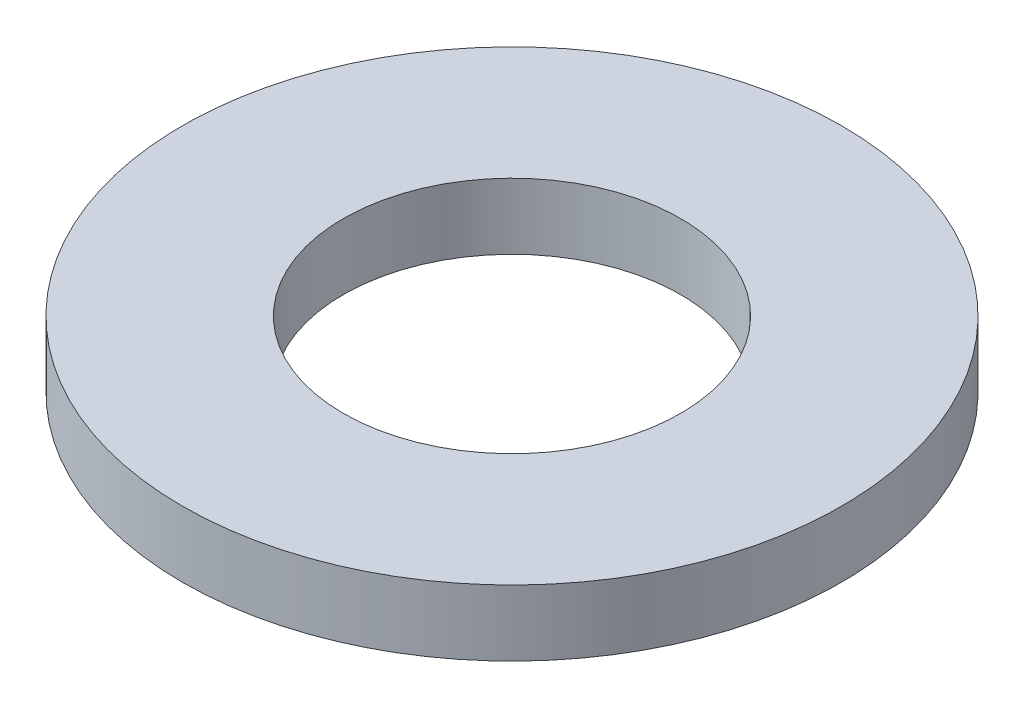
from build123d import *

# Parameters (mm, degrees)
SKETCH1_R           = 6.35
SKETCH1_R_2         = 3.2512
BOSS_EXTRUDE1_DEPTH = 1.27


with BuildPart() as part:
    # Sketch1 → Boss-Extrude1 (new body)
    with BuildSketch(Plane(origin=(0, 0, 0), x_dir=(1, 0, 0), z_dir=(0, 1, 0))):
        with Locations(Location((0, 0, 0), (0, 0, 270))):
            Circle(SKETCH1_R)
        with Locations(Location((0, 0, 0), (0, 0, 270))):
            Circle(SKETCH1_R_2, mode=Mode.SUBTRACT)
    extrude(amount=BOSS_EXTRUDE1_DEPTH)


solid = part.part
